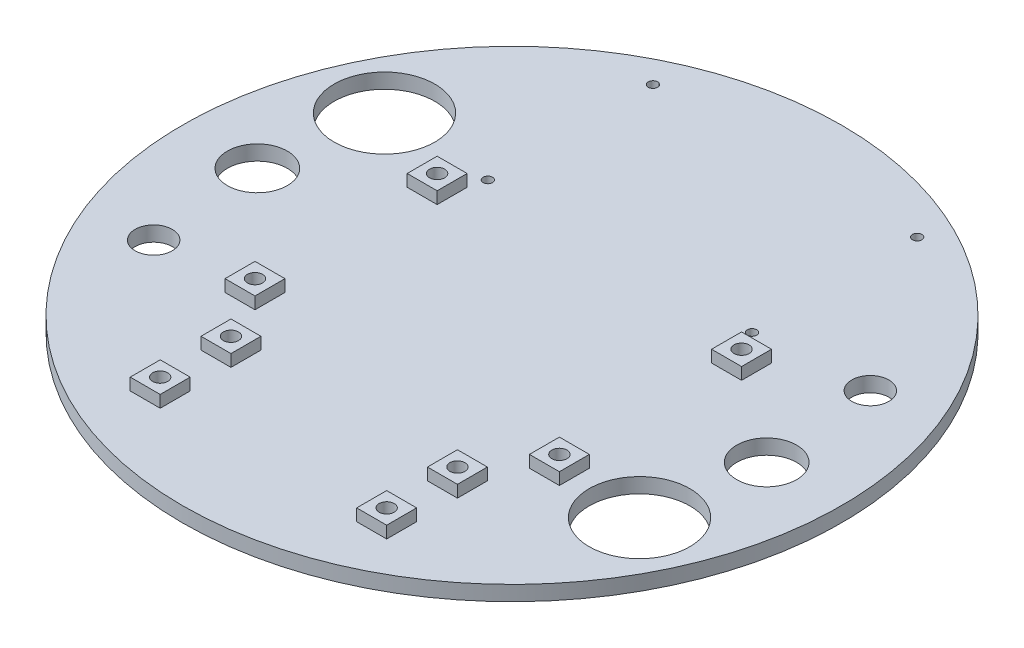
from build123d import *

# Parameters (mm, degrees)
SKETCH1_R           = 69.85
SKETCH1_R_2         = 3.937
SKETCH1_R_3         = 6.35
SKETCH1_R_4         = 10.668
BOSS_EXTRUDE1_DEPTH = 3.175
SKETCH5_R           = 1.00000054
CUT_EXTRUDE1_DEPTH  = 25.4
SKETCH2_R           = 1.600000102
SKETCH2_R_2         = 1.6
CUT_EXTRUDE2_DEPTH  = 25.4
BOSS_EXTRUDE2_START = 2.54
SKETCH2_9_W         = 6.35
SKETCH2_9_H         = 6.35
SKETCH2_9_R         = 1.6
SKETCH2_9_R_2       = 1.600000102
BOSS_EXTRUDE2_DEPTH = 2.54


with BuildPart() as part:
    # Sketch1 → Boss-Extrude1 (new body)
    with BuildSketch(Plane(origin=(0, 0, 0), x_dir=(1, 0, 0), z_dir=(0, 1, 0))):
        Circle(SKETCH1_R)
        with Locations((-51.795490029, -24.152633658)):
            Circle(SKETCH1_R_2, mode=Mode.SUBTRACT)
        with Locations((-53.975, 0)):
            Circle(SKETCH1_R_3, mode=Mode.SUBTRACT)
        with Locations((-50.64447914, 23.615908466)):
            Circle(SKETCH1_R_4, mode=Mode.SUBTRACT)
        with Locations((51.795490029, 24.152633658)):
            Circle(SKETCH1_R_2, mode=Mode.SUBTRACT)
        with Locations((53.975, 0)):
            Circle(SKETCH1_R_3, mode=Mode.SUBTRACT)
        with Locations((50.64447914, -23.615908466)):
            Circle(SKETCH1_R_4, mode=Mode.SUBTRACT)
    extrude(amount=BOSS_EXTRUDE1_DEPTH)

    # Sketch5 → Cut-Extrude1 (cut)
    with BuildSketch(Plane(origin=(0, 3.175, 0), x_dir=(1, 0, 0), z_dir=(0, 1, 0))):
        with Locations((-27.422738659, 57.298926561)):
            Circle(SKETCH5_R)
        with Locations((28.577261341, 57.298926561)):
            Circle(SKETCH5_R)
        with Locations((28.577261341, 22.298926561)):
            Circle(SKETCH5_R)
        with Locations((-27.422738659, 22.298926561)):
            Circle(SKETCH5_R)
    extrude(amount=-CUT_EXTRUDE1_DEPTH, mode=Mode.SUBTRACT)

    # Sketch2 → Cut-Extrude2 (cut)
    with BuildSketch(Plane(origin=(0, 3.175, 0), x_dir=(1, 0, 0), z_dir=(0, 1, 0))):
        with Locations((-23.404626028, -36.160958579)):
            Circle(SKETCH2_R)
        with Locations((24.595373972, -36.160958579)):
            Circle(SKETCH2_R)
        with Locations((-23.404626028, -51.160958579)):
            Circle(SKETCH2_R)
        with Locations((24.595373972, -51.160958579)):
            Circle(SKETCH2_R)
        with Locations((-31.436025901, 15.570800323)):
            Circle(SKETCH2_R_2)
        with Locations((33.083974099, 15.570800323)):
            Circle(SKETCH2_R)
        with Locations((-31.436025901, -23.039199677)):
            Circle(SKETCH2_R)
        with Locations((33.083974099, -23.039199677)):
            Circle(SKETCH2_R)
    extrude(amount=-CUT_EXTRUDE2_DEPTH, mode=Mode.SUBTRACT)

    # Sketch2<9> → Boss-Extrude2 (add)
    # profile 1 of 8: a face of its own
    with BuildSketch(Plane(origin=(0, 3.175, 0), x_dir=(1, 0, 0), z_dir=(0, 1, 0)).offset(BOSS_EXTRUDE2_START)):
        with Locations((-31.436025901, 15.570800323)):
            Rectangle(SKETCH2_9_W, SKETCH2_9_H)
        with Locations((-31.436025901, 15.570800323)):
            Circle(SKETCH2_9_R, mode=Mode.SUBTRACT)
    # profile 2 of 8: a face of its own
    with BuildSketch(Plane(origin=(0, 3.175, 0), x_dir=(1, 0, 0), z_dir=(0, 1, 0)).offset(BOSS_EXTRUDE2_START)):
        with Locations((-23.404626028, -36.160958579)):
            Rectangle(SKETCH2_9_W, SKETCH2_9_H)
        with Locations((-23.404626028, -36.160958579)):
            Circle(SKETCH2_9_R_2, mode=Mode.SUBTRACT)
    # profile 3 of 8: a face of its own
    with BuildSketch(Plane(origin=(0, 3.175, 0), x_dir=(1, 0, 0), z_dir=(0, 1, 0)).offset(BOSS_EXTRUDE2_START)):
        with Locations((24.595373972, -36.160958579)):
            Rectangle(SKETCH2_9_W, SKETCH2_9_H)
        with Locations((24.595373972, -36.160958579)):
            Circle(SKETCH2_9_R_2, mode=Mode.SUBTRACT)
    # profile 4 of 8: a face of its own
    with BuildSketch(Plane(origin=(0, 3.175, 0), x_dir=(1, 0, 0), z_dir=(0, 1, 0)).offset(BOSS_EXTRUDE2_START)):
        with Locations((-23.404626028, -51.160958579)):
            Rectangle(SKETCH2_9_W, SKETCH2_9_H)
        with Locations((-23.404626028, -51.160958579)):
            Circle(SKETCH2_9_R_2, mode=Mode.SUBTRACT)
    # profile 5 of 8: a face of its own
    with BuildSketch(Plane(origin=(0, 3.175, 0), x_dir=(1, 0, 0), z_dir=(0, 1, 0)).offset(BOSS_EXTRUDE2_START)):
        with Locations((24.595373972, -51.160958579)):
            Rectangle(SKETCH2_9_W, SKETCH2_9_H)
        with Locations((24.595373972, -51.160958579)):
            Circle(SKETCH2_9_R_2, mode=Mode.SUBTRACT)
    # profile 6 of 8: a face of its own
    with BuildSketch(Plane(origin=(0, 3.175, 0), x_dir=(1, 0, 0), z_dir=(0, 1, 0)).offset(BOSS_EXTRUDE2_START)):
        with Locations((-31.436025901, -23.039199677)):
            Rectangle(SKETCH2_9_W, SKETCH2_9_H)
        with Locations((-31.436025901, -23.039199677)):
            Circle(SKETCH2_9_R_2, mode=Mode.SUBTRACT)
    # profile 7 of 8: a face of its own
    with BuildSketch(Plane(origin=(0, 3.175, 0), x_dir=(1, 0, 0), z_dir=(0, 1, 0)).offset(BOSS_EXTRUDE2_START)):
        with Locations((33.083974099, -23.039199677)):
            Rectangle(SKETCH2_9_W, SKETCH2_9_H)
        with Locations((33.083974099, -23.039199677)):
            Circle(SKETCH2_9_R_2, mode=Mode.SUBTRACT)
    # profile 8 of 8: a face of its own
    with BuildSketch(Plane(origin=(0, 3.175, 0), x_dir=(1, 0, 0), z_dir=(0, 1, 0)).offset(BOSS_EXTRUDE2_START)):
        with Locations((33.083974099, 15.570800323)):
            Rectangle(SKETCH2_9_W, SKETCH2_9_H)
        with Locations((33.083974099, 15.570800323)):
            Circle(SKETCH2_9_R_2, mode=Mode.SUBTRACT)
    extrude(amount=-BOSS_EXTRUDE2_DEPTH)


solid = part.part
